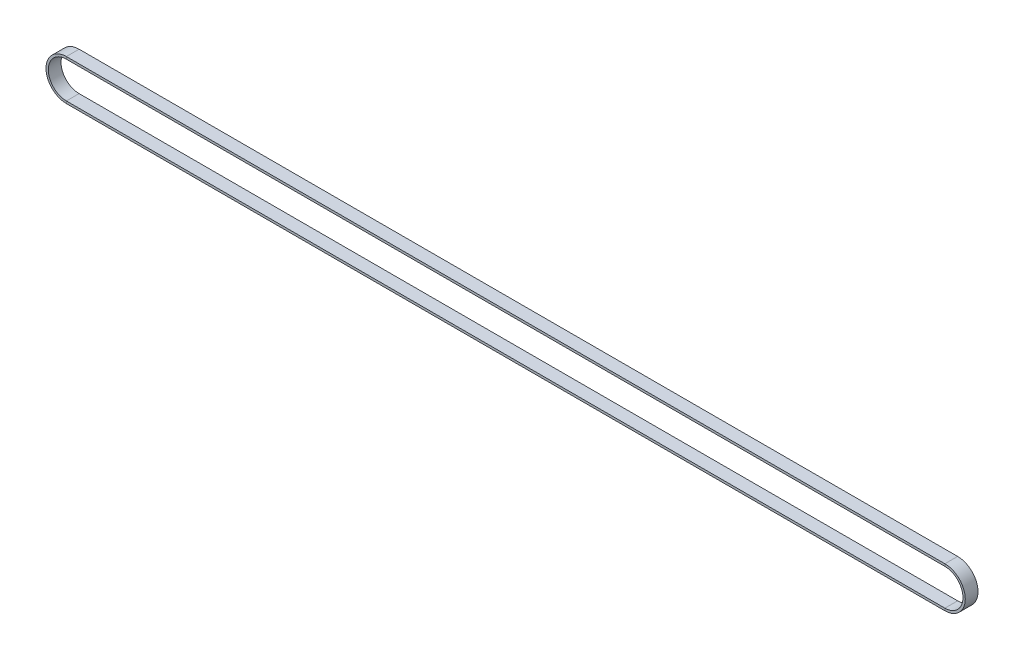
from build123d import *

# Parameters (mm, degrees)
SKETCH3_W = 6.35
SKETCH3_H = 1.143


with BuildPart() as part:
    # Sweep1: sweep along a path in Sketch2
    with BuildLine(Plane.XY) as sweep1_path:
        Line((0, 10.16), (438.15, 10.16))
        ThreePointArc((438.15, 10.16), (448.31, 0), (438.15, -10.16))
        Line((438.15, -10.16), (0, -10.16))
        ThreePointArc((0, -10.16), (-10.16, 0), (0, 10.16))
    # Sketch3 → Sweep1 (sweep)
    with BuildSketch(Plane(origin=(0, 10.16, 0), x_dir=(0, 0, -1), z_dir=(1, 0, 0))):
        with Locations((0, -0.5715)):
            Rectangle(SKETCH3_W, SKETCH3_H)
    sweep(path=sweep1_path.line)


solid = part.part
